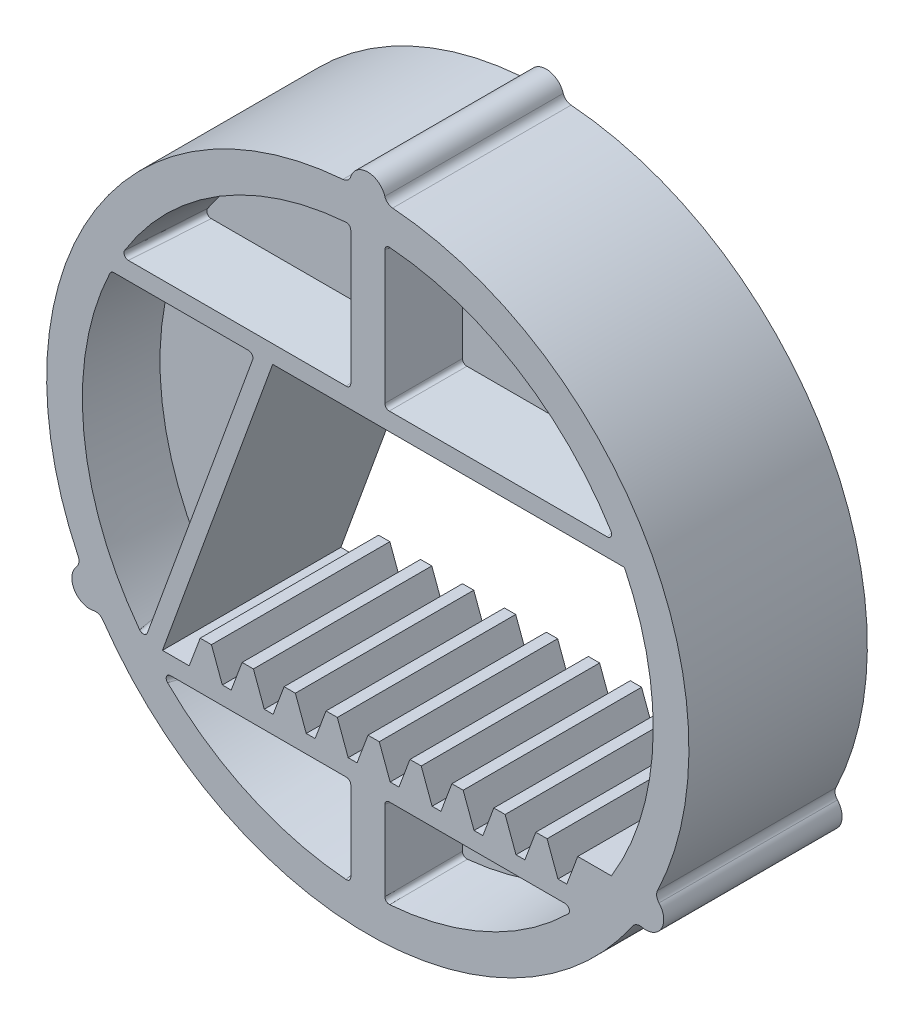
from build123d import *

# Parameters (mm, degrees)
BOSS_EXTRU_1_DEPTH                = 5
ENL_V_MAT_EXTRU_1_DEPTH           = 4
ENL_V_MAT_EXTRU_1_DRAFT           = -5
ENL_V_MAT_EXTRU_1_PROFILE_2_DEPTH = 4
ENL_V_MAT_EXTRU_1_PROFILE_2_DRAFT = -5
ENL_V_MAT_EXTRU_1_PROFILE_3_DEPTH = 4
ENL_V_MAT_EXTRU_1_PROFILE_3_DRAFT = -5
ENL_V_MAT_EXTRU_1_PROFILE_4_DEPTH = 4
ENL_V_MAT_EXTRU_1_PROFILE_4_DRAFT = -5
ENL_V_MAT_EXTRU_1_PROFILE_5_DEPTH = 4
ENL_V_MAT_EXTRU_1_PROFILE_5_DRAFT = -5
CONG_1_R                          = 0.25
SYM_TRIE1_COPY_1_DEPTH            = 4
SYM_TRIE1_COPY_1_DRAFT            = -5
SYM_TRIE1_COPY_2_DEPTH            = 4
SYM_TRIE1_COPY_2_DRAFT            = -5
SYM_TRIE1_COPY_3_DEPTH            = 4
SYM_TRIE1_COPY_3_DRAFT            = -5
SYM_TRIE1_COPY_4_DEPTH            = 4
SYM_TRIE1_COPY_4_DRAFT            = -5
SYM_TRIE1_COPY_5_DEPTH            = 4
SYM_TRIE1_COPY_5_DRAFT            = -5
SYM_TRIE1_COPY_6_DEPTH            = 4
SYM_TRIE1_COPY_6_DRAFT            = -5
SYM_TRIE1_COPY_7_DEPTH            = 4
SYM_TRIE1_COPY_7_DRAFT            = -5
SYM_TRIE1_COPY_8_DEPTH            = 4
SYM_TRIE1_COPY_8_DRAFT            = -5
SYM_TRIE1_COPY_9_DEPTH            = 4
SYM_TRIE1_COPY_9_DRAFT            = -5
CONG_1_OF_SYM_TRIE1_R             = 0.25


with BuildPart() as part:
    # Esquisse1 → Boss.-Extru.1 (new, symmetric)
    with BuildSketch(Plane.XY):
        with BuildLine():
            ThreePointArc((-15.367509352, -9.975285609), (-15.074622025, -9.9973907), (-14.844683086, -10.180146564))
            ThreePointArc((-14.844683086, -10.180146564), (0, -18), (14.844683086, -10.180146564))
            ThreePointArc((14.844683086, -10.180146564), (15.074622025, -9.9973907), (15.367509352, -9.975285609))
            ThreePointArc((15.367509352, -9.975285609), (16.454482672, -9.5), (16.322605423, -8.321010688))
            ThreePointArc((16.322605423, -8.321010688), (16.19530533, -8.056310276), (16.238607082, -7.765799382))
            ThreePointArc((16.238607082, -7.765799382), (15.588457268, 9), (1.393923995, 17.945945946))
            ThreePointArc((1.393923995, 17.945945946), (1.120683305, 18.053700976), (0.955096071, 18.296296296))
            ThreePointArc((0.955096071, 18.296296296), (0, 19), (-0.955096071, 18.296296296))
            ThreePointArc((-0.955096071, 18.296296296), (-1.120683305, 18.053700976), (-1.393923995, 17.945945946))
            ThreePointArc((-1.393923995, 17.945945946), (-15.588457268, 9), (-16.238607082, -7.765799382))
            ThreePointArc((-16.238607082, -7.765799382), (-16.19530533, -8.056310276), (-16.322605423, -8.321010688))
            ThreePointArc((-16.322605423, -8.321010688), (-16.454482672, -9.5), (-15.367509352, -9.975285609))
        make_face()
        with BuildLine():
            Line((-5.331244604, 7), (14.38749457, 7))
            ThreePointArc((14.38749457, 7), (15.981739721, -0.764195974), (13.653943789, -8.340852415))
            Line((13.653943789, -8.340852415), (11.768206401, -8.340852415))
            Line((11.768206401, -8.340852415), (11.154006631, -9.990852415))
            Line((11.154006631, -9.990852415), (10.658353575, -9.990852415))
            Line((10.658353575, -9.990852415), (10.048820527, -8.33912277))
            Line((10.048820527, -8.33912277), (9.416678633, -8.33912277))
            Line((9.416678633, -8.33912277), (8.802478863, -9.98912277))
            Line((8.802478863, -9.98912277), (8.306825807, -9.98912277))
            Line((8.306825807, -9.98912277), (7.697292758, -8.337393125))
            Line((7.697292758, -8.337393125), (7.065150865, -8.337393125))
            Line((7.065150865, -8.337393125), (6.450951094, -9.987393125))
            Line((6.450951094, -9.987393125), (5.955298038, -9.987393125))
            Line((5.955298038, -9.987393125), (5.34576499, -8.33566348))
            Line((5.34576499, -8.33566348), (4.713623096, -8.33566348))
            Line((4.713623096, -8.33566348), (4.099423326, -9.98566348))
            Line((4.099423326, -9.98566348), (3.60377027, -9.98566348))
            Line((3.60377027, -9.98566348), (2.994237222, -8.333933835))
            Line((2.994237222, -8.333933835), (2.362095328, -8.333933835))
            Line((2.362095328, -8.333933835), (1.747895558, -9.983933835))
            Line((1.747895558, -9.983933835), (1.252242502, -9.983933835))
            Line((1.252242502, -9.983933835), (0.642709453, -8.332204189))
            Line((0.642709453, -8.332204189), (0.01056756, -8.332204189))
            Line((0.01056756, -8.332204189), (-0.603632211, -9.982204189))
            Line((-0.603632211, -9.982204189), (-1.099285266, -9.982204189))
            Line((-1.099285266, -9.982204189), (-1.708818315, -8.330474544))
            Line((-1.708818315, -8.330474544), (-2.340960209, -8.330474544))
            Line((-2.340960209, -8.330474544), (-2.955159979, -9.980474544))
            Line((-2.955159979, -9.980474544), (-3.450813035, -9.980474544))
            Line((-3.450813035, -9.980474544), (-4.060346083, -8.328744899))
            Line((-4.060346083, -8.328744899), (-4.692487977, -8.328744899))
            Line((-4.692487977, -8.328744899), (-5.306687747, -9.978744899))
            Line((-5.306687747, -9.978744899), (-5.802340803, -9.978744899))
            Line((-5.802340803, -9.978744899), (-6.411873851, -8.327015254))
            Line((-6.411873851, -8.327015254), (-7.044015745, -8.327015254))
            Line((-7.044015745, -8.327015254), (-7.658215515, -9.977015254))
            Line((-7.658215515, -9.977015254), (-8.153868571, -9.977015254))
            Line((-8.153868571, -9.977015254), (-8.76340162, -8.325285609))
            Line((-8.76340162, -8.325285609), (-9.395543513, -8.325285609))
            Line((-9.395543513, -8.325285609), (-10.009743284, -9.975285609))
            Line((-10.009743284, -9.975285609), (-11.509743284, -9.975285609))
            Line((-11.509743284, -9.975285609), (-5.331244604, 7))
        make_face(mode=Mode.SUBTRACT)
    extrude(amount=BOSS_EXTRU_1_DEPTH, both=True)


with BuildPart() as enl_v_mat_extru_1_tool:
    # Esquisse2 → Enlèv. mat.-Extru.1 (with draft: the straight prism first)
    with BuildSketch(Plane.XY.offset(5)):
        with BuildLine():
            Line((-6.331244604, 7), (-14.38749457, 7))
            ThreePointArc((-14.38749457, 7), (-15.903000705, -1.759138592), (-12.509743284, -9.975285609))
            Line((-12.509743284, -9.975285609), (-6.331244604, 7))
        make_face()
    extrude(amount=-ENL_V_MAT_EXTRU_1_DEPTH)
    # Enlèv. mat.-Extru.1: the draft: its side faces are tilted about the plane it starts from
    enl_v_mat_extru_1_sides = [enl_v_mat_extru_1_tool.faces().sort_by_distance(p)[0] for p in [
        (-9.420493944, -1.487642804, 3),
        (-10.359369587, 7, 3),
        (-15.903000705, -1.759138592, 3),
    ]]
    draft(enl_v_mat_extru_1_sides, Plane.XY.offset(5), ENL_V_MAT_EXTRU_1_DRAFT)


with BuildPart() as part_1:
    add(part.part)

    # Enlèv. mat.-Extru.1: cut by enl_v_mat_extru_1_tool
    add(enl_v_mat_extru_1_tool.part, mode=Mode.SUBTRACT)


with BuildPart() as enl_v_mat_extru_1_profile_2_tool:
    # Esquisse2 → Enlèv. mat.-Extru.1 profile 2 (with draft: the straight prism first)
    with BuildSketch(Plane.XY.offset(5)):
        with BuildLine():
            ThreePointArc((-0.955096071, 15.971468044), (-8.410185938, 13.611347196), (-13.856406461, 8))
            Line((-13.856406461, 8), (-0.955096071, 8))
            Line((-0.955096071, 8), (-0.955096071, 15.971468044))
        make_face()
    extrude(amount=-ENL_V_MAT_EXTRU_1_PROFILE_2_DEPTH)
    # Enlèv. mat.-Extru.1 profile 2: the draft: its side faces are tilted about the plane it starts from
    enl_v_mat_extru_1_profile_2_sides = [enl_v_mat_extru_1_profile_2_tool.faces().sort_by_distance(p)[0] for p in [
        (-8.410185938, 13.611347196, 3),
        (-7.405751266, 8, 3),
        (-0.955096071, 11.985734022, 3),
    ]]
    draft(enl_v_mat_extru_1_profile_2_sides, Plane.XY.offset(5), ENL_V_MAT_EXTRU_1_PROFILE_2_DRAFT)


with BuildPart() as part_2:
    add(part_1.part)

    # Enlèv. mat.-Extru.1 profile 2: cut by enl_v_mat_extru_1_profile_2_tool
    add(enl_v_mat_extru_1_profile_2_tool.part, mode=Mode.SUBTRACT)


with BuildPart() as enl_v_mat_extru_1_profile_3_tool:
    # Esquisse2 → Enlèv. mat.-Extru.1 profile 3 (with draft: the straight prism first)
    with BuildSketch(Plane.XY.offset(5)):
        with BuildLine():
            Line((0.955096071, 15.971468044), (0.955096071, 8))
            Line((0.955096071, 8), (13.856406461, 8))
            ThreePointArc((13.856406461, 8), (8.410185938, 13.611347196), (0.955096071, 15.971468044))
        make_face()
    extrude(amount=-ENL_V_MAT_EXTRU_1_PROFILE_3_DEPTH)
    # Enlèv. mat.-Extru.1 profile 3: the draft: its side faces are tilted about the plane it starts from
    enl_v_mat_extru_1_profile_3_sides = [enl_v_mat_extru_1_profile_3_tool.faces().sort_by_distance(p)[0] for p in [
        (0.955096071, 11.985734022, 3),
        (7.405751266, 8, 3),
        (8.410185938, 13.611347196, 3),
    ]]
    draft(enl_v_mat_extru_1_profile_3_sides, Plane.XY.offset(5), ENL_V_MAT_EXTRU_1_PROFILE_3_DRAFT)


with BuildPart() as part_3:
    add(part_2.part)

    # Enlèv. mat.-Extru.1 profile 3: cut by enl_v_mat_extru_1_profile_3_tool
    add(enl_v_mat_extru_1_profile_3_tool.part, mode=Mode.SUBTRACT)


with BuildPart() as enl_v_mat_extru_1_profile_4_tool:
    # Esquisse2 → Enlèv. mat.-Extru.1 profile 4 (with draft: the straight prism first)
    with BuildSketch(Plane.XY.offset(5)):
        with BuildLine():
            ThreePointArc((-11.642298133, -10.975285609), (-6.775990327, -14.494342175), (-0.955096071, -15.971468044))
            Line((-0.955096071, -15.971468044), (-0.955096071, -10.975285609))
            Line((-0.955096071, -10.975285609), (-11.642298133, -10.975285609))
        make_face()
    extrude(amount=-ENL_V_MAT_EXTRU_1_PROFILE_4_DEPTH)
    # Enlèv. mat.-Extru.1 profile 4: the draft: its side faces are tilted about the plane it starts from
    enl_v_mat_extru_1_profile_4_sides = [enl_v_mat_extru_1_profile_4_tool.faces().sort_by_distance(p)[0] for p in [
        (-6.775990327, -14.494342175, 3),
        (-0.955096071, -13.473376827, 3),
        (-6.298697102, -10.975285609, 3),
    ]]
    draft(enl_v_mat_extru_1_profile_4_sides, Plane.XY.offset(5), ENL_V_MAT_EXTRU_1_PROFILE_4_DRAFT)


with BuildPart() as part_4:
    add(part_3.part)

    # Enlèv. mat.-Extru.1 profile 4: cut by enl_v_mat_extru_1_profile_4_tool
    add(enl_v_mat_extru_1_profile_4_tool.part, mode=Mode.SUBTRACT)


with BuildPart() as enl_v_mat_extru_1_profile_5_tool:
    # Esquisse2 → Enlèv. mat.-Extru.1 profile 5 (with draft: the straight prism first)
    with BuildSketch(Plane.XY.offset(5)):
        with BuildLine():
            ThreePointArc((0.955096071, -15.971468044), (6.775990327, -14.494342175), (11.642298133, -10.975285609))
            Line((11.642298133, -10.975285609), (0.955096071, -10.975285609))
            Line((0.955096071, -10.975285609), (0.955096071, -15.971468044))
        make_face()
    extrude(amount=-ENL_V_MAT_EXTRU_1_PROFILE_5_DEPTH)
    # Enlèv. mat.-Extru.1 profile 5: the draft: its side faces are tilted about the plane it starts from
    enl_v_mat_extru_1_profile_5_sides = [enl_v_mat_extru_1_profile_5_tool.faces().sort_by_distance(p)[0] for p in [
        (6.775990327, -14.494342175, 3),
        (6.298697102, -10.975285609, 3),
        (0.955096071, -13.473376827, 3),
    ]]
    draft(enl_v_mat_extru_1_profile_5_sides, Plane.XY.offset(5), ENL_V_MAT_EXTRU_1_PROFILE_5_DRAFT)


with BuildPart() as part_5:
    add(part_4.part)

    # Enlèv. mat.-Extru.1 profile 5: cut by enl_v_mat_extru_1_profile_5_tool
    add(enl_v_mat_extru_1_profile_5_tool.part, mode=Mode.SUBTRACT)

    # Congé1
    cong_1_edges = [part_5.edges().sort_by_distance(p)[0] for p in [
        (11.229227033, -11.150400827, 2.998423898),
        (1.130082452, -15.784611801, 2.999896517),
        (1.130073398, -11.150262936, 3),
        (-1.130082452, -15.784611801, 2.999896517),
        (-11.229227033, -11.150400827, 2.998423898),
        (-1.130073398, -11.150262936, 3),
        (-13.549865322, 8.175023953, 2.99946706),
        (-1.130082452, 15.784611801, 2.999896517),
        (-1.130073398, 8.174977327, 3),
        (1.130082452, 15.784611801, 2.999896517),
        (13.549865322, 8.175023953, 2.99946706),
        (1.130073398, 8.174977327, 3),
        (-6.581138125, 6.825022673, 3),
        (-12.566224701, -9.618716164, 2.999408194),
        (-14.277617851, 6.825020639, 2.99997675),
    ]]
    fillet(cong_1_edges, radius=CONG_1_R)


with BuildPart() as sym_trie1_copy_1_tool:
    # Symétrie1 copy 1 sketch → Symétrie1 copy 1 (with draft: the straight prism first)
    with BuildSketch(Plane(origin=(0, 0, -5), x_dir=(1, 0, 0), z_dir=(0, 0, -1))):
        with BuildLine():
            Line((-6.331244604, -7), (-14.38749457, -7))
            ThreePointArc((-14.38749457, -7), (-15.903000705, 1.759138592), (-12.509743284, 9.975285609))
            Line((-12.509743284, 9.975285609), (-6.331244604, -7))
        make_face()
    extrude(amount=-SYM_TRIE1_COPY_1_DEPTH)
    # Symétrie1 copy 1: the draft: its side faces are tilted about the plane it starts from
    sym_trie1_copy_1_sides = [sym_trie1_copy_1_tool.faces().sort_by_distance(p)[0] for p in [
        (-9.420493944, -1.487642804, -3),
        (-10.359369587, 7, -3),
        (-15.903000705, -1.759138592, -3),
    ]]
    draft(sym_trie1_copy_1_sides, Plane(origin=(0, 0, -5), x_dir=(1, 0, 0), z_dir=(0, 0, -1)), SYM_TRIE1_COPY_1_DRAFT)


with BuildPart() as part_6:
    add(part_5.part)

    # Symétrie1 copy 1: cut by sym_trie1_copy_1_tool
    add(sym_trie1_copy_1_tool.part, mode=Mode.SUBTRACT)


with BuildPart() as sym_trie1_copy_2_tool:
    # Symétrie1 copy 2 sketch → Symétrie1 copy 2 (with draft: the straight prism first)
    with BuildSketch(Plane(origin=(0, 0, -5), x_dir=(1, 0, 0), z_dir=(0, 0, -1))):
        with BuildLine():
            ThreePointArc((-0.955096071, -15.971468044), (-8.410185938, -13.611347196), (-13.856406461, -8))
            Line((-13.856406461, -8), (-0.955096071, -8))
            Line((-0.955096071, -8), (-0.955096071, -15.971468044))
        make_face()
    extrude(amount=-SYM_TRIE1_COPY_2_DEPTH)
    # Symétrie1 copy 2: the draft: its side faces are tilted about the plane it starts from
    sym_trie1_copy_2_sides = [sym_trie1_copy_2_tool.faces().sort_by_distance(p)[0] for p in [
        (-8.410185938, 13.611347196, -3),
        (-7.405751266, 8, -3),
        (-0.955096071, 11.985734022, -3),
    ]]
    draft(sym_trie1_copy_2_sides, Plane(origin=(0, 0, -5), x_dir=(1, 0, 0), z_dir=(0, 0, -1)), SYM_TRIE1_COPY_2_DRAFT)


with BuildPart() as part_7:
    add(part_6.part)

    # Symétrie1 copy 2: cut by sym_trie1_copy_2_tool
    add(sym_trie1_copy_2_tool.part, mode=Mode.SUBTRACT)


with BuildPart() as sym_trie1_copy_3_tool:
    # Symétrie1 copy 3 sketch → Symétrie1 copy 3 (with draft: the straight prism first)
    with BuildSketch(Plane(origin=(0, 0, -5), x_dir=(1, 0, 0), z_dir=(0, 0, -1))):
        with BuildLine():
            Line((0.955096071, -15.971468044), (0.955096071, -8))
            Line((0.955096071, -8), (13.856406461, -8))
            ThreePointArc((13.856406461, -8), (8.410185938, -13.611347196), (0.955096071, -15.971468044))
        make_face()
    extrude(amount=-SYM_TRIE1_COPY_3_DEPTH)
    # Symétrie1 copy 3: the draft: its side faces are tilted about the plane it starts from
    sym_trie1_copy_3_sides = [sym_trie1_copy_3_tool.faces().sort_by_distance(p)[0] for p in [
        (0.955096071, 11.985734022, -3),
        (7.405751266, 8, -3),
        (8.410185938, 13.611347196, -3),
    ]]
    draft(sym_trie1_copy_3_sides, Plane(origin=(0, 0, -5), x_dir=(1, 0, 0), z_dir=(0, 0, -1)), SYM_TRIE1_COPY_3_DRAFT)


with BuildPart() as part_8:
    add(part_7.part)

    # Symétrie1 copy 3: cut by sym_trie1_copy_3_tool
    add(sym_trie1_copy_3_tool.part, mode=Mode.SUBTRACT)


with BuildPart() as sym_trie1_copy_4_tool:
    # Symétrie1 copy 4 sketch → Symétrie1 copy 4 (with draft: the straight prism first)
    with BuildSketch(Plane(origin=(0, 0, -5), x_dir=(1, 0, 0), z_dir=(0, 0, -1))):
        with BuildLine():
            ThreePointArc((-11.642298133, 10.975285609), (-6.775990327, 14.494342175), (-0.955096071, 15.971468044))
            Line((-0.955096071, 15.971468044), (-0.955096071, 10.975285609))
            Line((-0.955096071, 10.975285609), (-11.642298133, 10.975285609))
        make_face()
    extrude(amount=-SYM_TRIE1_COPY_4_DEPTH)
    # Symétrie1 copy 4: the draft: its side faces are tilted about the plane it starts from
    sym_trie1_copy_4_sides = [sym_trie1_copy_4_tool.faces().sort_by_distance(p)[0] for p in [
        (-6.775990327, -14.494342175, -3),
        (-0.955096071, -13.473376827, -3),
        (-6.298697102, -10.975285609, -3),
    ]]
    draft(sym_trie1_copy_4_sides, Plane(origin=(0, 0, -5), x_dir=(1, 0, 0), z_dir=(0, 0, -1)), SYM_TRIE1_COPY_4_DRAFT)


with BuildPart() as part_9:
    add(part_8.part)

    # Symétrie1 copy 4: cut by sym_trie1_copy_4_tool
    add(sym_trie1_copy_4_tool.part, mode=Mode.SUBTRACT)


with BuildPart() as sym_trie1_copy_5_tool:
    # Symétrie1 copy 5 sketch → Symétrie1 copy 5 (with draft: the straight prism first)
    with BuildSketch(Plane(origin=(0, 0, -5), x_dir=(1, 0, 0), z_dir=(0, 0, -1))):
        with BuildLine():
            ThreePointArc((0.955096071, 15.971468044), (6.775990327, 14.494342175), (11.642298133, 10.975285609))
            Line((11.642298133, 10.975285609), (0.955096071, 10.975285609))
            Line((0.955096071, 10.975285609), (0.955096071, 15.971468044))
        make_face()
    extrude(amount=-SYM_TRIE1_COPY_5_DEPTH)
    # Symétrie1 copy 5: the draft: its side faces are tilted about the plane it starts from
    sym_trie1_copy_5_sides = [sym_trie1_copy_5_tool.faces().sort_by_distance(p)[0] for p in [
        (6.775990327, -14.494342175, -3),
        (6.298697102, -10.975285609, -3),
        (0.955096071, -13.473376827, -3),
    ]]
    draft(sym_trie1_copy_5_sides, Plane(origin=(0, 0, -5), x_dir=(1, 0, 0), z_dir=(0, 0, -1)), SYM_TRIE1_COPY_5_DRAFT)


with BuildPart() as part_10:
    add(part_9.part)

    # Symétrie1 copy 5: cut by sym_trie1_copy_5_tool
    add(sym_trie1_copy_5_tool.part, mode=Mode.SUBTRACT)


with BuildPart() as sym_trie1_copy_6_tool:
    # Symétrie1 copy 6 sketch → Symétrie1 copy 6 (with draft: the straight prism first)
    with BuildSketch(Plane(origin=(0, 0, -5), x_dir=(1, 0, 0), z_dir=(0, 0, -1))):
        with BuildLine():
            ThreePointArc((-0.955096071, -15.971468044), (-8.410185938, -13.611347196), (-13.856406461, -8))
            Line((-13.856406461, -8), (-0.955096071, -8))
            Line((-0.955096071, -8), (-0.955096071, -15.971468044))
        make_face()
    extrude(amount=-SYM_TRIE1_COPY_6_DEPTH)
    # Symétrie1 copy 6: the draft: its side faces are tilted about the plane it starts from
    sym_trie1_copy_6_sides = [sym_trie1_copy_6_tool.faces().sort_by_distance(p)[0] for p in [
        (-8.410185938, 13.611347196, -3),
        (-7.405751266, 8, -3),
        (-0.955096071, 11.985734022, -3),
    ]]
    draft(sym_trie1_copy_6_sides, Plane(origin=(0, 0, -5), x_dir=(1, 0, 0), z_dir=(0, 0, -1)), SYM_TRIE1_COPY_6_DRAFT)


with BuildPart() as part_11:
    add(part_10.part)

    # Symétrie1 copy 6: cut by sym_trie1_copy_6_tool
    add(sym_trie1_copy_6_tool.part, mode=Mode.SUBTRACT)


with BuildPart() as sym_trie1_copy_7_tool:
    # Symétrie1 copy 7 sketch → Symétrie1 copy 7 (with draft: the straight prism first)
    with BuildSketch(Plane(origin=(0, 0, -5), x_dir=(1, 0, 0), z_dir=(0, 0, -1))):
        with BuildLine():
            Line((0.955096071, -15.971468044), (0.955096071, -8))
            Line((0.955096071, -8), (13.856406461, -8))
            ThreePointArc((13.856406461, -8), (8.410185938, -13.611347196), (0.955096071, -15.971468044))
        make_face()
    extrude(amount=-SYM_TRIE1_COPY_7_DEPTH)
    # Symétrie1 copy 7: the draft: its side faces are tilted about the plane it starts from
    sym_trie1_copy_7_sides = [sym_trie1_copy_7_tool.faces().sort_by_distance(p)[0] for p in [
        (0.955096071, 11.985734022, -3),
        (7.405751266, 8, -3),
        (8.410185938, 13.611347196, -3),
    ]]
    draft(sym_trie1_copy_7_sides, Plane(origin=(0, 0, -5), x_dir=(1, 0, 0), z_dir=(0, 0, -1)), SYM_TRIE1_COPY_7_DRAFT)


with BuildPart() as part_12:
    add(part_11.part)

    # Symétrie1 copy 7: cut by sym_trie1_copy_7_tool
    add(sym_trie1_copy_7_tool.part, mode=Mode.SUBTRACT)


with BuildPart() as sym_trie1_copy_8_tool:
    # Symétrie1 copy 8 sketch → Symétrie1 copy 8 (with draft: the straight prism first)
    with BuildSketch(Plane(origin=(0, 0, -5), x_dir=(1, 0, 0), z_dir=(0, 0, -1))):
        with BuildLine():
            ThreePointArc((-11.642298133, 10.975285609), (-6.775990327, 14.494342175), (-0.955096071, 15.971468044))
            Line((-0.955096071, 15.971468044), (-0.955096071, 10.975285609))
            Line((-0.955096071, 10.975285609), (-11.642298133, 10.975285609))
        make_face()
    extrude(amount=-SYM_TRIE1_COPY_8_DEPTH)
    # Symétrie1 copy 8: the draft: its side faces are tilted about the plane it starts from
    sym_trie1_copy_8_sides = [sym_trie1_copy_8_tool.faces().sort_by_distance(p)[0] for p in [
        (-6.775990327, -14.494342175, -3),
        (-0.955096071, -13.473376827, -3),
        (-6.298697102, -10.975285609, -3),
    ]]
    draft(sym_trie1_copy_8_sides, Plane(origin=(0, 0, -5), x_dir=(1, 0, 0), z_dir=(0, 0, -1)), SYM_TRIE1_COPY_8_DRAFT)


with BuildPart() as part_13:
    add(part_12.part)

    # Symétrie1 copy 8: cut by sym_trie1_copy_8_tool
    add(sym_trie1_copy_8_tool.part, mode=Mode.SUBTRACT)


with BuildPart() as sym_trie1_copy_9_tool:
    # Symétrie1 copy 9 sketch → Symétrie1 copy 9 (with draft: the straight prism first)
    with BuildSketch(Plane(origin=(0, 0, -5), x_dir=(1, 0, 0), z_dir=(0, 0, -1))):
        with BuildLine():
            ThreePointArc((0.955096071, 15.971468044), (6.775990327, 14.494342175), (11.642298133, 10.975285609))
            Line((11.642298133, 10.975285609), (0.955096071, 10.975285609))
            Line((0.955096071, 10.975285609), (0.955096071, 15.971468044))
        make_face()
    extrude(amount=-SYM_TRIE1_COPY_9_DEPTH)
    # Symétrie1 copy 9: the draft: its side faces are tilted about the plane it starts from
    sym_trie1_copy_9_sides = [sym_trie1_copy_9_tool.faces().sort_by_distance(p)[0] for p in [
        (6.775990327, -14.494342175, -3),
        (6.298697102, -10.975285609, -3),
        (0.955096071, -13.473376827, -3),
    ]]
    draft(sym_trie1_copy_9_sides, Plane(origin=(0, 0, -5), x_dir=(1, 0, 0), z_dir=(0, 0, -1)), SYM_TRIE1_COPY_9_DRAFT)


with BuildPart() as part_14:
    add(part_13.part)

    # Symétrie1 copy 9: cut by sym_trie1_copy_9_tool
    add(sym_trie1_copy_9_tool.part, mode=Mode.SUBTRACT)

    # Congé1 of Symétrie1
    cong_1_of_sym_trie1_edges = [part_14.edges().sort_by_distance(p)[0] for p in [
        (11.229227033, -11.150400827, -2.998423898),
        (1.130082452, -15.784611801, -2.999896517),
        (1.130073398, -11.150262936, -3),
        (-1.130082452, -15.784611801, -2.999896517),
        (-11.229227033, -11.150400827, -2.998423898),
        (-1.130073398, -11.150262936, -3),
        (-13.549865322, 8.175023953, -2.99946706),
        (-1.130082452, 15.784611801, -2.999896517),
        (-1.130073398, 8.174977327, -3),
        (1.130082452, 15.784611801, -2.999896517),
        (13.549865322, 8.175023953, -2.99946706),
        (1.130073398, 8.174977327, -3),
        (-6.581138125, 6.825022673, -3),
        (-12.566224701, -9.618716164, -2.999408194),
        (-14.277617851, 6.825020639, -2.99997675),
    ]]
    fillet(cong_1_of_sym_trie1_edges, radius=CONG_1_OF_SYM_TRIE1_R)


solid = part_14.part
